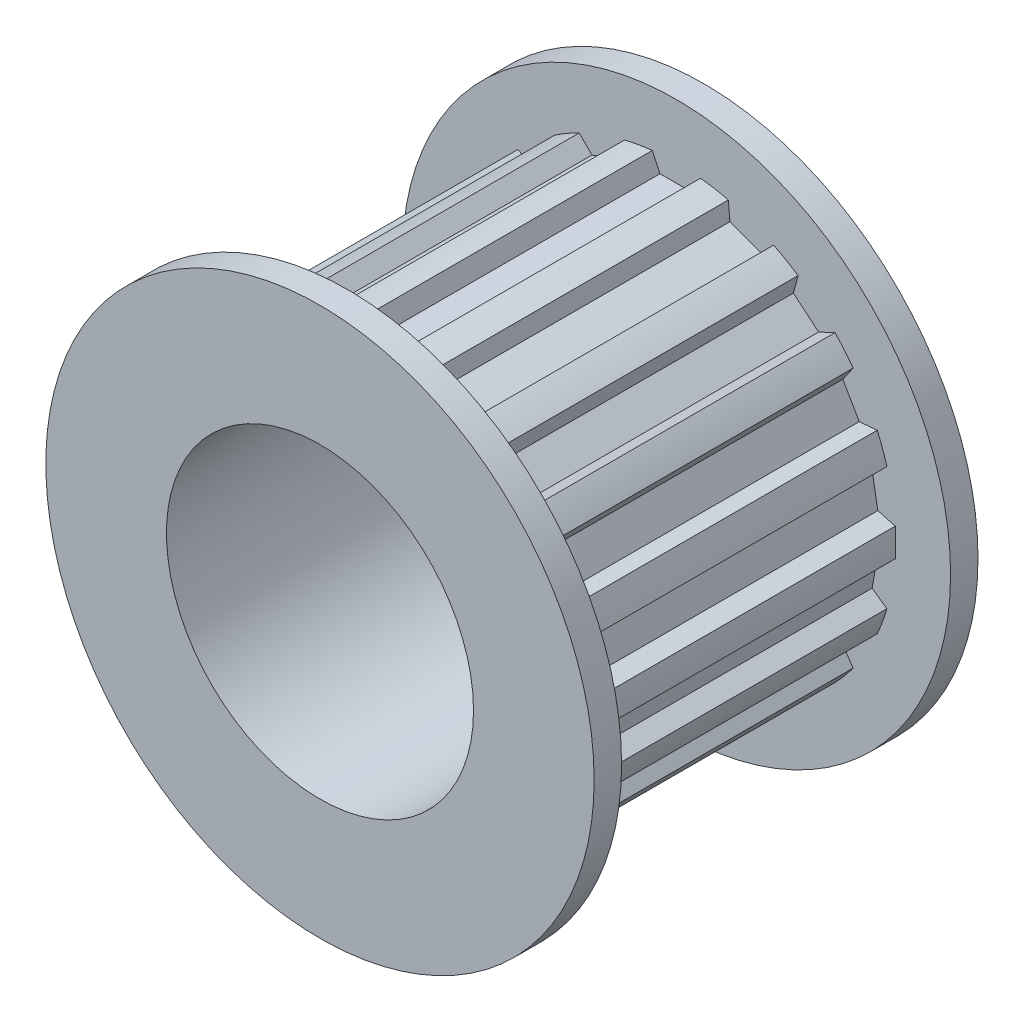
from build123d import *

# Parameters (mm, degrees)
ESQUISSE1_R                  = 8
ESQUISSE1_R_2                = 5.6
EXTRUSION1_DEPTH             = 12
EXTRUSION2_DEPTH             = 17.492422502
R_P_TITION_CIRCULAIRE1_COUNT = 18
ESQUISSE3_R                  = 10
ESQUISSE3_R_2                = 5.6
EXTRUSION3_DEPTH             = 1
R_P_TITION_LIN_AIRE1_COUNT   = 2
R_P_TITION_LIN_AIRE1_PITCH   = 13


with BuildPart() as part:
    # Esquisse1 → Extrusion1 (new body)
    with BuildSketch(Plane.XY):
        Circle(ESQUISSE1_R)
        Circle(ESQUISSE1_R_2, mode=Mode.SUBTRACT)
    extrude(amount=EXTRUSION1_DEPTH)

    # Esquisse2 → Extrusion2 (cut, through all)
    with BuildSketch(Plane.XY.offset(12)):
        Polygon((-0.6, 7.353512063), (0.6, 7.353512063), (1.002277566, 8.216199086), (-1.002277566, 8.216199086), align=None)
    extrusion2 = extrude(amount=-EXTRUSION2_DEPTH, mode=Mode.SUBTRACT)

    # Répétition circulaire1: Extrusion2 ×18 about axis
    r_p_tition_circulaire1_axis = Axis((0, 0, 0), (0, 0, 1))
    for i in range(1, R_P_TITION_CIRCULAIRE1_COUNT):
        add(extrusion2.rotate(r_p_tition_circulaire1_axis, i * 360 / R_P_TITION_CIRCULAIRE1_COUNT), mode=Mode.SUBTRACT)

    # Esquisse3 → Extrusion3 (add)
    with BuildSketch(Plane.XY.offset(12)):
        Circle(ESQUISSE3_R)
        Circle(ESQUISSE3_R_2, mode=Mode.SUBTRACT)
    extrusion3 = extrude(amount=EXTRUSION3_DEPTH)

    # Répétition linéaire1: Extrusion3 ×2
    with Locations(*[(0, 0, -i * R_P_TITION_LIN_AIRE1_PITCH) for i in range(1, R_P_TITION_LIN_AIRE1_COUNT)]):
        add(extrusion3)


solid = part.part
